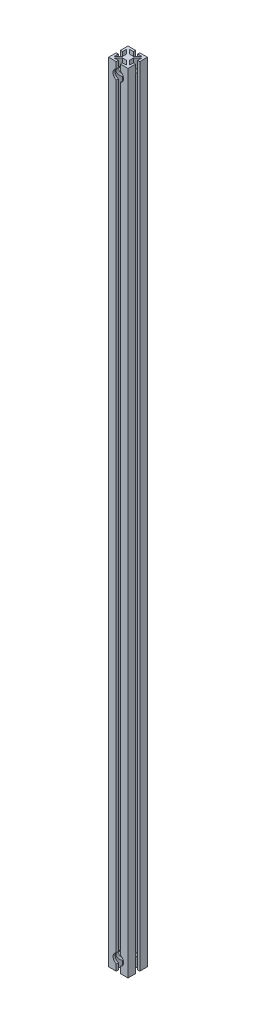
from build123d import *

# Parameters (mm, degrees)
BOSS_EXTRUDE1_DEPTH     = 1546.225
SKETCH3_R               = 10.287
CUT_EXTRUDE1_DEPTH      = 16.51
MIRROR2_COPY_1_SKETCH_R = 10.287
MIRROR2_COPY_1_DEPTH    = 16.51


with BuildPart() as part:
    # Sketch2 → Boss-Extrude1 (new body)
    with BuildSketch(Plane(origin=(0.594697292, 0, 0.594697292), x_dir=(1, 0, 0), z_dir=(0, 1, 0))):
        Polygon((-19.644697292, 19.644697292), (-4.658697292, 19.644697292), (-4.658697292, 15.580697292), (-12.707015333, 15.580697292), (-4.477415333, 7.351097292), (3.288020749, 7.351097292), (11.517620749, 15.580697292), (3.469302708, 15.580697292), (3.469302708, 19.644697292), (18.455302708, 19.644697292), (18.455302708, 4.658697292), (14.391302708, 4.658697292), (14.391302708, 12.707015333), (6.161702708, 4.477415333), (6.161702708, -3.288020749), (14.391302708, -11.517620749), (14.391302708, -3.469302708), (18.455302708, -3.469302708), (18.455302708, -18.455302708), (3.469302708, -18.455302708), (3.469302708, -14.391302708), (11.517620749, -14.391302708), (3.288020749, -6.161702708), (-4.477415333, -6.161702708), (-12.707015333, -14.391302708), (-4.658697292, -14.391302708), (-4.658697292, -18.455302708), (-19.644697292, -18.455302708), (-19.644697292, -3.469302708), (-15.580697292, -3.469302708), (-15.580697292, -11.517620749), (-7.351097292, -3.288020749), (-7.351097292, 4.477415333), (-15.580697292, 12.707015333), (-15.580697292, 4.658697292), (-19.644697292, 4.658697292), align=None)
    extrude(amount=BOSS_EXTRUDE1_DEPTH)

    # Sketch3 → Cut-Extrude1 (cut)
    with BuildSketch(Plane.XY.offset(19.05)):
        with Locations(Location((0, 21.844, 0), (0, 0, 48.944473627))):
            Circle(SKETCH3_R)
    cut_extrude1 = extrude(amount=-CUT_EXTRUDE1_DEPTH, mode=Mode.SUBTRACT)

    # Mirror1: Cut-Extrude1 across plane
    add(cut_extrude1.mirror(Plane.XY), mode=Mode.SUBTRACT)

    # Mirror2: Cut-Extrude1 across plane
    add(cut_extrude1.mirror(Plane.ZX.offset(773.1125)), mode=Mode.SUBTRACT)

    # Mirror2 copy 1 sketch → Mirror2 copy 1 (cut)
    with BuildSketch(Plane(origin=(0, 1546.225, -19.05), x_dir=(1, 0, 0), z_dir=(0, 0, -1))):
        with Locations(Location((0, 21.844, 0), (0, 0, 48.944473627))):
            Circle(MIRROR2_COPY_1_SKETCH_R)
    extrude(amount=-MIRROR2_COPY_1_DEPTH, mode=Mode.SUBTRACT)


solid = part.part
